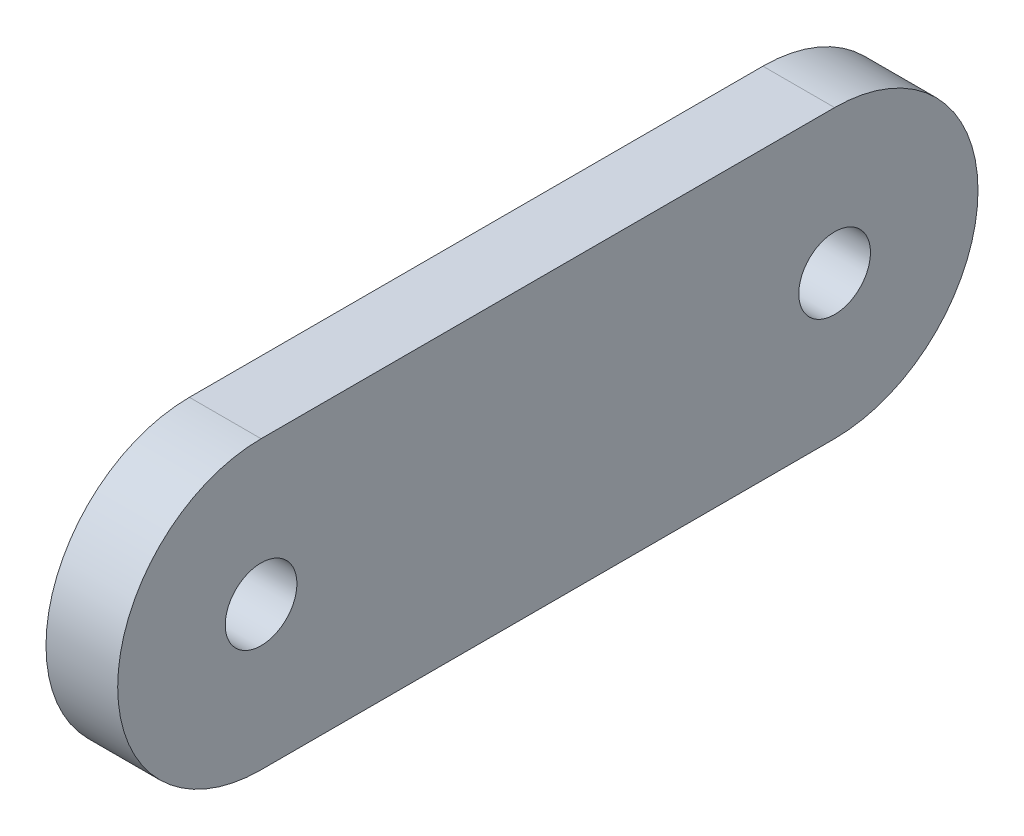
from build123d import *

# Parameters (mm, degrees)
SKETCH1_R           = 2.5
BOSS_EXTRUDE1_DEPTH = 5


with BuildPart() as part:
    # Sketch1 → Boss-Extrude1 (new body)
    with BuildSketch(Plane(origin=(0, 0, 0), x_dir=(0, 0, -1), z_dir=(1, 0, 0))):
        with BuildLine():
            Line((0, 10), (40, 10))
            ThreePointArc((40, 10), (50, 0), (40, -10))
            Line((40, -10), (0, -10))
            ThreePointArc((0, -10), (-10, 0), (0, 10))
        make_face()
        Circle(SKETCH1_R, mode=Mode.SUBTRACT)
        with Locations((40, 0)):
            Circle(SKETCH1_R, mode=Mode.SUBTRACT)
    extrude(amount=BOSS_EXTRUDE1_DEPTH)


solid = part.part
